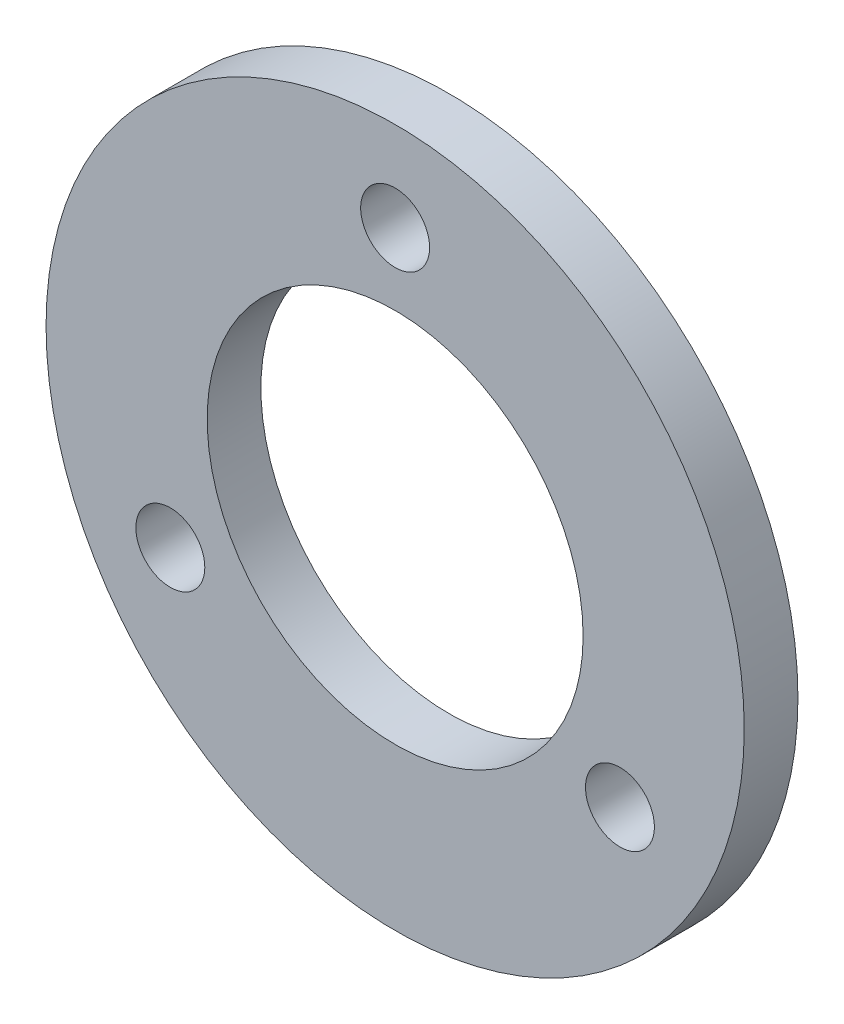
from build123d import *

# Parameters (mm, degrees)
ESQUISSE1_R        = 19.5
ESQUISSE1_R_2      = 10.5
ESQUISSE1_R_3      = 1.925
BOSS_EXTRU_1_DEPTH = 3


with BuildPart() as part:
    # Esquisse1 → Boss.-Extru.1 (new body)
    with BuildSketch(Plane.XY):
        Circle(ESQUISSE1_R)
        Circle(ESQUISSE1_R_2, mode=Mode.SUBTRACT)
        with Locations((12.557368355, -7.25)):
            Circle(ESQUISSE1_R_3, mode=Mode.SUBTRACT)
        with Locations((-12.557368355, -7.25)):
            Circle(ESQUISSE1_R_3, mode=Mode.SUBTRACT)
        with Locations((0, 14.5)):
            Circle(ESQUISSE1_R_3, mode=Mode.SUBTRACT)
    extrude(amount=BOSS_EXTRU_1_DEPTH)


solid = part.part
